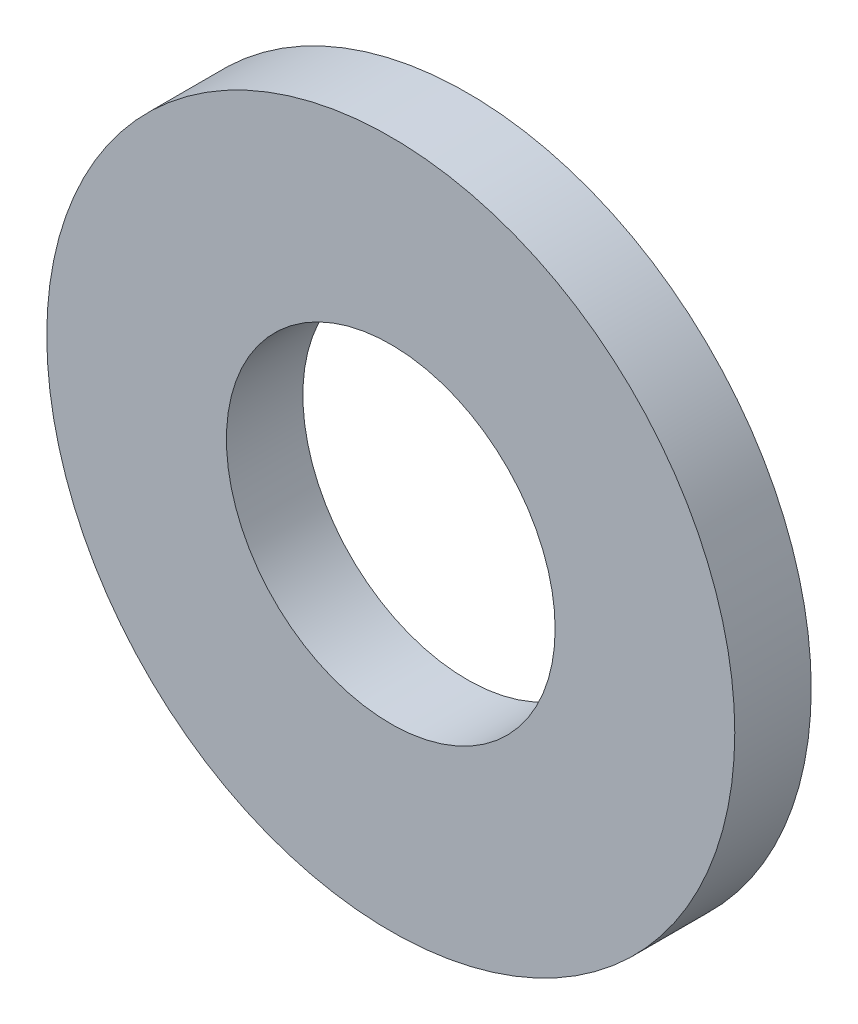
from build123d import *

# Parameters (mm, degrees)
SKETCH1_R           = 4.5
SKETCH1_R_2         = 2.15
BOSS_EXTRUDE1_DEPTH = 1


with BuildPart() as part:
    # Sketch1 → Boss-Extrude1 (new body)
    with BuildSketch(Plane.XY):
        Circle(SKETCH1_R)
        Circle(SKETCH1_R_2, mode=Mode.SUBTRACT)
    extrude(amount=BOSS_EXTRUDE1_DEPTH)


solid = part.part
